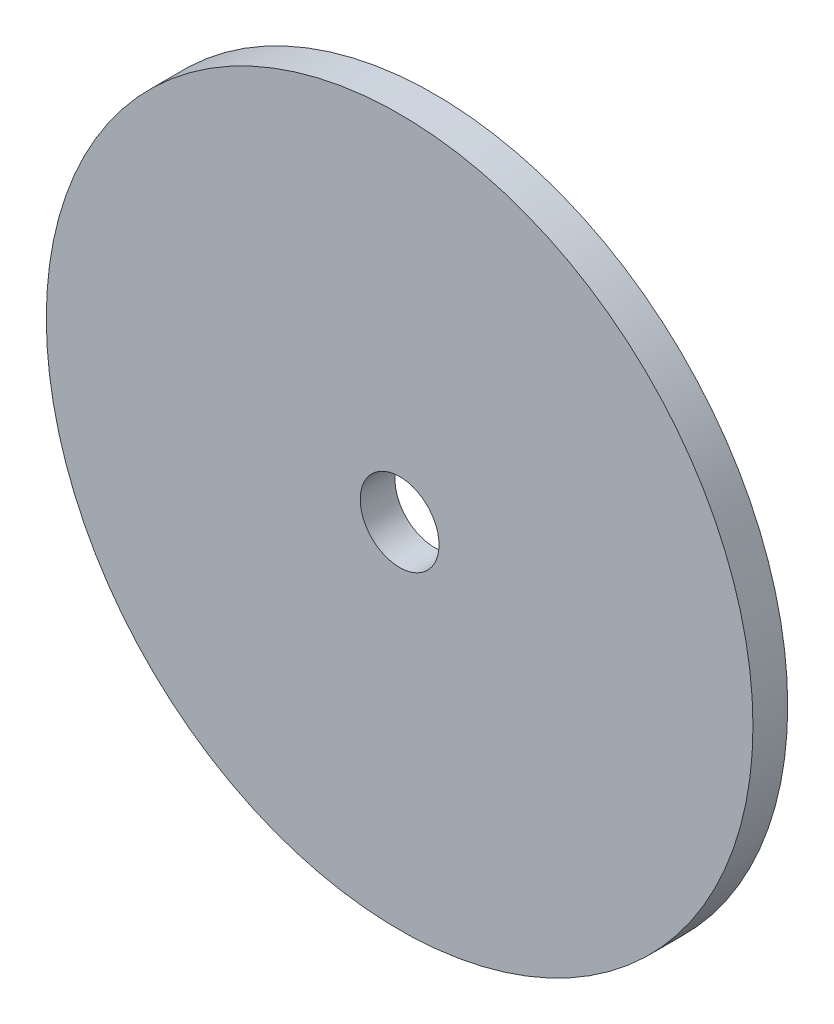
from build123d import *

# Parameters (mm, degrees)
MODEL_R             = 30.5
MODEL_R_2           = 3.4
BOSS_EXTRUDE1_DEPTH = 3


with BuildPart() as part:
    # Model → Boss-Extrude1 (new body)
    with BuildSketch(Plane.XY):
        Circle(MODEL_R)
        Circle(MODEL_R_2, mode=Mode.SUBTRACT)
    extrude(amount=BOSS_EXTRUDE1_DEPTH)


solid = part.part
